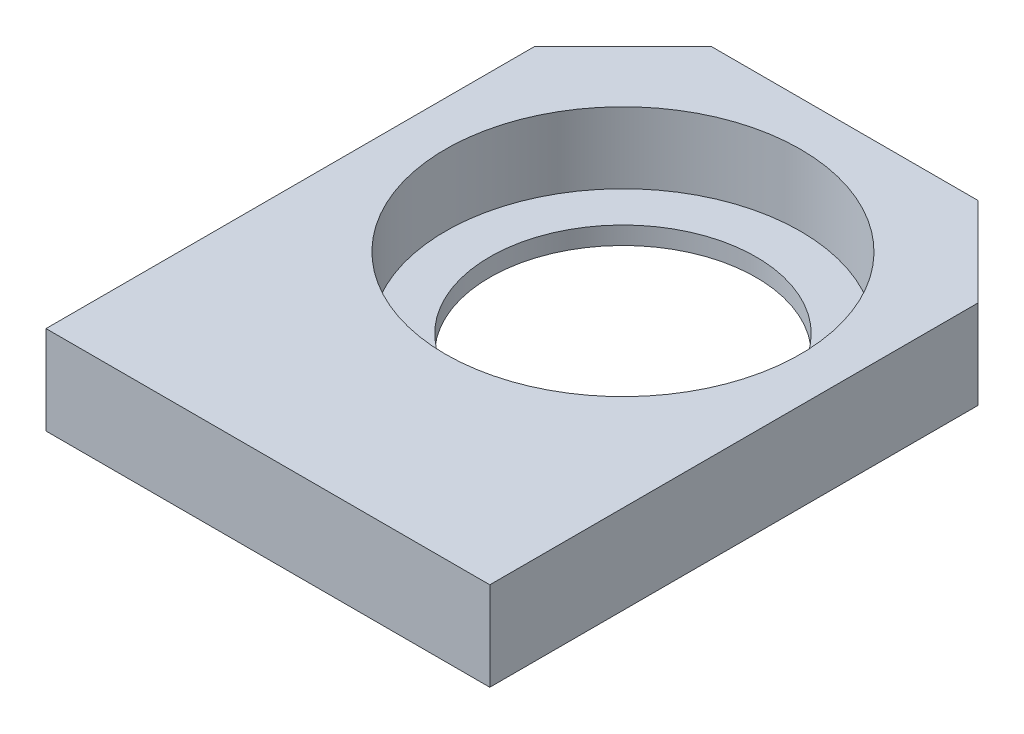
from build123d import *

# Parameters (mm, degrees)
SKETCH1_W           = 41.275
SKETCH1_H           = 6.35
BOSS_EXTRUDE1_DEPTH = 15.875
SKETCH4_R           = 12.7
CUT_EXTRUDE4_DEPTH  = 5.08
SKETCH5_R           = 9.525
CUT_EXTRUDE5_DEPTH  = 6.35
CHAMFER1_SIZE       = 6.35


with BuildPart() as part:
    # Sketch1 → Boss-Extrude1 (new, symmetric)
    with BuildSketch(Plane(origin=(0, 0, 0), x_dir=(0, 0, -1), z_dir=(1, 0, 0))):
        with Locations((0, 3.175)):
            Rectangle(SKETCH1_W, SKETCH1_H)
    extrude(amount=BOSS_EXTRUDE1_DEPTH, both=True)

    # Sketch4 → Cut-Extrude4 (cut)
    with BuildSketch(Plane(origin=(0, 6.35, 0), x_dir=(1, 0, 0), z_dir=(0, 1, 0))):
        with Locations(Location((0, 4.7625, 0), (0, 0, 270))):
            Circle(SKETCH4_R)
    extrude(amount=-CUT_EXTRUDE4_DEPTH, mode=Mode.SUBTRACT)

    # Sketch5 → Cut-Extrude5 (cut)
    with BuildSketch(Plane(origin=(0, 1.27, 0), x_dir=(1, 0, 0), z_dir=(0, 1, 0))):
        with Locations(Location((0, 4.7625, 0), (0, 0, 270))):
            Circle(SKETCH5_R)
    extrude(amount=-CUT_EXTRUDE5_DEPTH, mode=Mode.SUBTRACT)

    # Chamfer1
    chamfer1_edges = [part.edges().sort_by_distance(p)[0] for p in [
        (15.875, 3.175, -20.6375),
        (-15.875, 3.175, -20.6375),
    ]]
    chamfer(chamfer1_edges, length=CHAMFER1_SIZE)


solid = part.part
